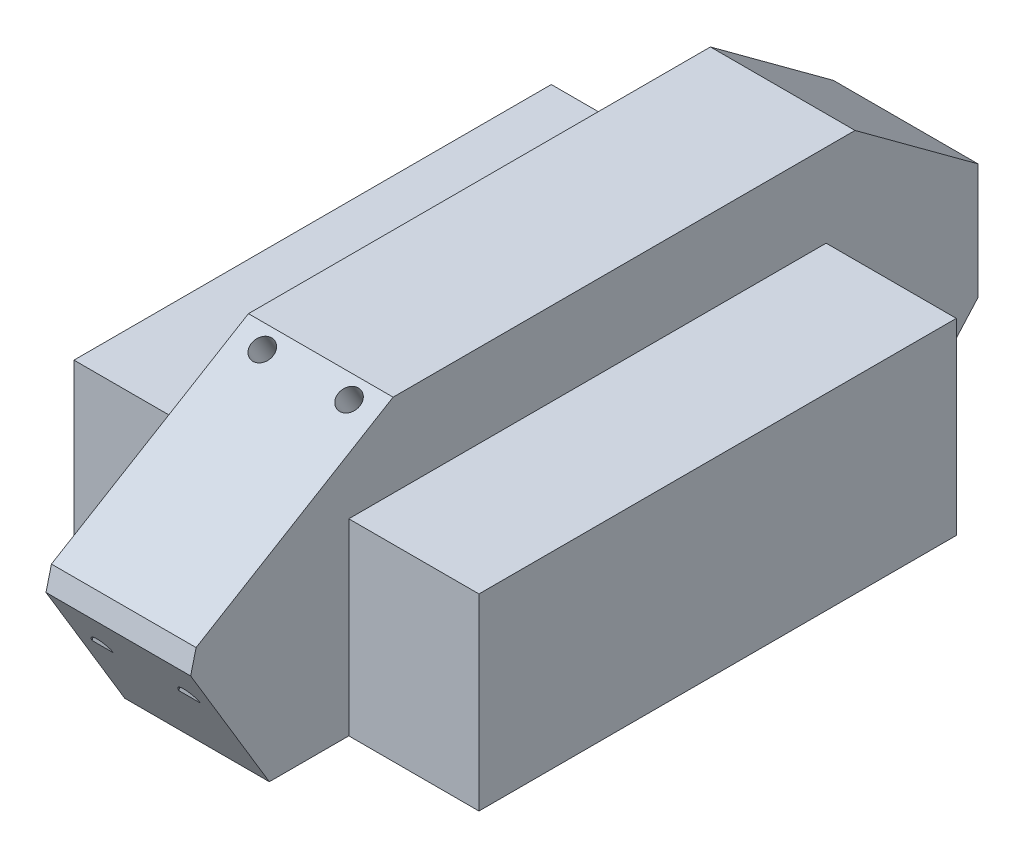
from build123d import *

# Parameters (mm, degrees)
SKETCH_1_W           = 20
SKETCH_1_H           = 110
EXTRUDE_1_DEPTH      = 38
EXTRUDE_4_DEPTH      = 32
EXTRUDE_4_DEPTH_BACK = 34
SKETCH_2_W           = 18
SKETCH_2_H           = 26
CUT_EXTRUDE_1_DEPTH  = 20
SKETCH_9_R           = 1.5
CUT_EXTRUDE_3_DEPTH  = 5
SKETCH_10_W          = 99.275483207
SKETCH_10_H          = 3
CUT_EXTRUDE_4_DEPTH  = 77.896033708
SKETCH_8_R           = 1.5
CUT_EXTRUDE_2_DEPTH  = 5
CUT_EXTRUDE_5_DEPTH  = 77.650179387
CUT_EXTRUDE_6_DEPTH  = 77.650179387
CHAMFER_1_SIZE       = 2.2


with BuildPart() as part:
    # 草图1 → 凸台-拉伸1 (new body)
    with BuildSketch(Plane(origin=(0, 0, 0), x_dir=(1, 0, 0), z_dir=(0, 1, 0))):
        Rectangle(SKETCH_1_W, SKETCH_1_H)
    extrude(amount=EXTRUDE_1_DEPTH)

    # 草图2 → 凸台-拉伸4 (add, two sides: drawn at the far end of the back side and taken through both)
    with BuildSketch(Plane.XY.offset(-EXTRUDE_4_DEPTH_BACK)):
        with Locations((19, 13)):
            Rectangle(SKETCH_2_W, SKETCH_2_H)
        with Locations((-19, 13)):
            Rectangle(SKETCH_2_W, SKETCH_2_H)
    extrude(amount=EXTRUDE_4_DEPTH + EXTRUDE_4_DEPTH_BACK)

    # 草图7 → 切除-拉伸1 (cut)
    with BuildSketch(Plane(origin=(10, 0, 0), x_dir=(0, 0, -1), z_dir=(1, 0, 0))):
        Polygon((-55, 38), (-55, 20), (-25.042969318, 38), align=None)
    extrude(amount=-CUT_EXTRUDE_1_DEPTH, mode=Mode.SUBTRACT)

    # 草图9 → 切除-拉伸3 (cut)
    with BuildSketch(Plane.XY.offset(55)):
        with Locations((-6, 11.5)):
            Circle(SKETCH_9_R)
        with Locations(Location((6, 11.5, 0), (0, 0, 180))):
            Circle(SKETCH_9_R)
    extrude(amount=-CUT_EXTRUDE_3_DEPTH, mode=Mode.SUBTRACT)

    # 草图10 → 切除-拉伸4 (cut, through all)
    with BuildSketch(Plane(origin=(10, 0, 0), x_dir=(0, 0, -1), z_dir=(1, 0, 0))):
        with Locations((8.83578939, 39)):
            Rectangle(SKETCH_10_W, SKETCH_10_H)
    extrude(amount=-CUT_EXTRUDE_4_DEPTH, mode=Mode.SUBTRACT)

    # 草图8 → 切除-拉伸2 (cut)
    with BuildSketch(Plane(origin=(0, 38.975774431, 23.419007952), x_dir=(1, 0, 0), z_dir=(0, 0.8571673007021134, 0.5150380749100524))):
        with Locations(Location((-6, -5.305369578, 0), (0, 0, 270))):
            Circle(SKETCH_8_R)
        with Locations(Location((6, -5.305369578, 0), (0, 0, 90))):
            Circle(SKETCH_8_R)
    extrude(amount=-CUT_EXTRUDE_2_DEPTH, mode=Mode.SUBTRACT)

    # 草图11 → 切除-拉伸5 (cut, through all)
    with BuildSketch(Plane(origin=(10, 0, 0), x_dir=(0, 0, -1), z_dir=(1, 0, 0))):
        Polygon((55, 37.5), (38, 37.5), (55, 25), align=None)
        Polygon((55, 0), (55, 9), (47, 0), align=None)
    extrude(amount=-CUT_EXTRUDE_5_DEPTH, mode=Mode.SUBTRACT)

    # 草图12 → 切除-拉伸6 (cut, through all)
    with BuildSketch(Plane(origin=(10, 0, 0), x_dir=(0, 0, -1), z_dir=(1, 0, 0))):
        Polygon((-55, 20), (-42.982787619, 0), (-55, 0), align=None)
    extrude(amount=-CUT_EXTRUDE_6_DEPTH, mode=Mode.SUBTRACT)

    # 倒角1
    chamfer_1_edges = [part.edges().sort_by_distance(p)[0] for p in [
        (0, 20, 55),
    ]]
    chamfer(chamfer_1_edges, length=CHAMFER_1_SIZE)


solid = part.part
